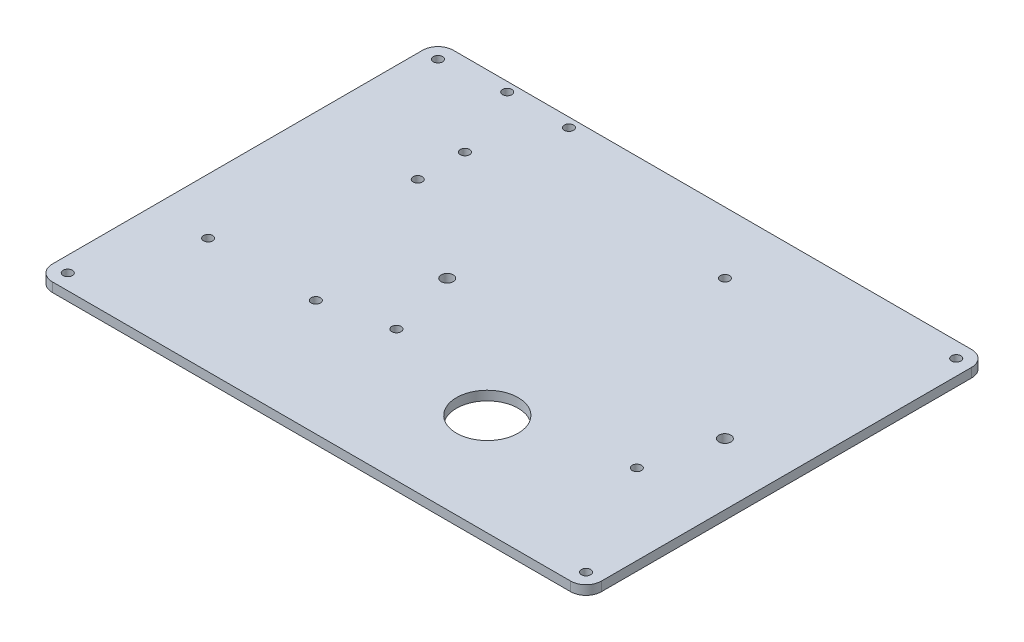
from build123d import *

# Parameters (mm, degrees)
SKETCH_1_R          = 1.5
SKETCH_1_R_2        = 1.95
SKETCH_1_R_3        = 10
EXTRUDE_1_DEPTH     = 3
SKETCH_2_R          = 1.5
CUT_EXTRUDE_1_DEPTH = 131.395552071


with BuildPart() as part:
    # 草图1 → 凸台-拉伸1 (new body)
    with BuildSketch(Plane(origin=(0, 0, 0), x_dir=(1, 0, 0), z_dir=(0, 1, 0))):
        with BuildLine():
            Line((-108, -65), (60, -65))
            ThreePointArc((60, -65), (63.535533906, -63.535533906), (65, -60))
            Line((65, -60), (65, 60))
            ThreePointArc((65, 60), (63.535533906, 63.535533906), (60, 65))
            Line((60, 65), (-108, 65))
            ThreePointArc((-108, 65), (-111.535533906, 63.535533906), (-113, 60))
            Line((-113, 60), (-113, -60))
            ThreePointArc((-113, -60), (-111.535533906, -63.535533906), (-108, -65))
        make_face()
        with Locations(Location((0, 45, 0), (0, 0, 270))):
            Circle(SKETCH_1_R, mode=Mode.SUBTRACT)
        with Locations(Location((-38.97114317, -22.5, 0), (0, 0, 270))):
            Circle(SKETCH_1_R, mode=Mode.SUBTRACT)
        with Locations(Location((38.97114317, -22.5, 0), (0, 0, 270))):
            Circle(SKETCH_1_R, mode=Mode.SUBTRACT)
        with Locations(Location((-45, 0, 0), (0, 0, 270))):
            Circle(SKETCH_1_R_2, mode=Mode.SUBTRACT)
        with Locations(Location((45, 0, 0), (0, 0, 270))):
            Circle(SKETCH_1_R_2, mode=Mode.SUBTRACT)
        with Locations(Location((-95, -27.5, 0), (0, 0, 270))):
            Circle(SKETCH_1_R, mode=Mode.SUBTRACT)
        with Locations(Location((-60.1, -27.5, 0), (0, 0, 90))):
            Circle(SKETCH_1_R, mode=Mode.SUBTRACT)
        with Locations(Location((-77.55, 23, 0), (0, 0, 270))):
            Circle(SKETCH_1_R, mode=Mode.SUBTRACT)
        with Locations(Location((-108, 60, 0), (0, 0, 270))):
            Circle(SKETCH_1_R, mode=Mode.SUBTRACT)
        with Locations(Location((60, 60, 0), (0, 0, 270))):
            Circle(SKETCH_1_R, mode=Mode.SUBTRACT)
        with Locations(Location((60, -60, 0), (0, 0, 270))):
            Circle(SKETCH_1_R, mode=Mode.SUBTRACT)
        with Locations(Location((-108, -60, 0), (0, 0, 270))):
            Circle(SKETCH_1_R, mode=Mode.SUBTRACT)
        with Locations(Location((0, -32, 0), (0, 0, 270))):
            Circle(SKETCH_1_R_3, mode=Mode.SUBTRACT)
    extrude(amount=EXTRUDE_1_DEPTH)

    # 草图2 → 切除-拉伸1 (cut, through all)
    with BuildSketch(Plane(origin=(0, 3, 0), x_dir=(1, 0, 0), z_dir=(0, 1, 0))):
        with Locations(Location((-87.55, 62, 0), (0, 0, 270))):
            Circle(SKETCH_2_R)
        with Locations(Location((-67.55, 62, 0), (0, 0, 270))):
            Circle(SKETCH_2_R)
        with Locations(Location((-77.55, 38.3, 0), (0, 0, 270))):
            Circle(SKETCH_2_R)
    extrude(amount=-CUT_EXTRUDE_1_DEPTH, mode=Mode.SUBTRACT)


solid = part.part
